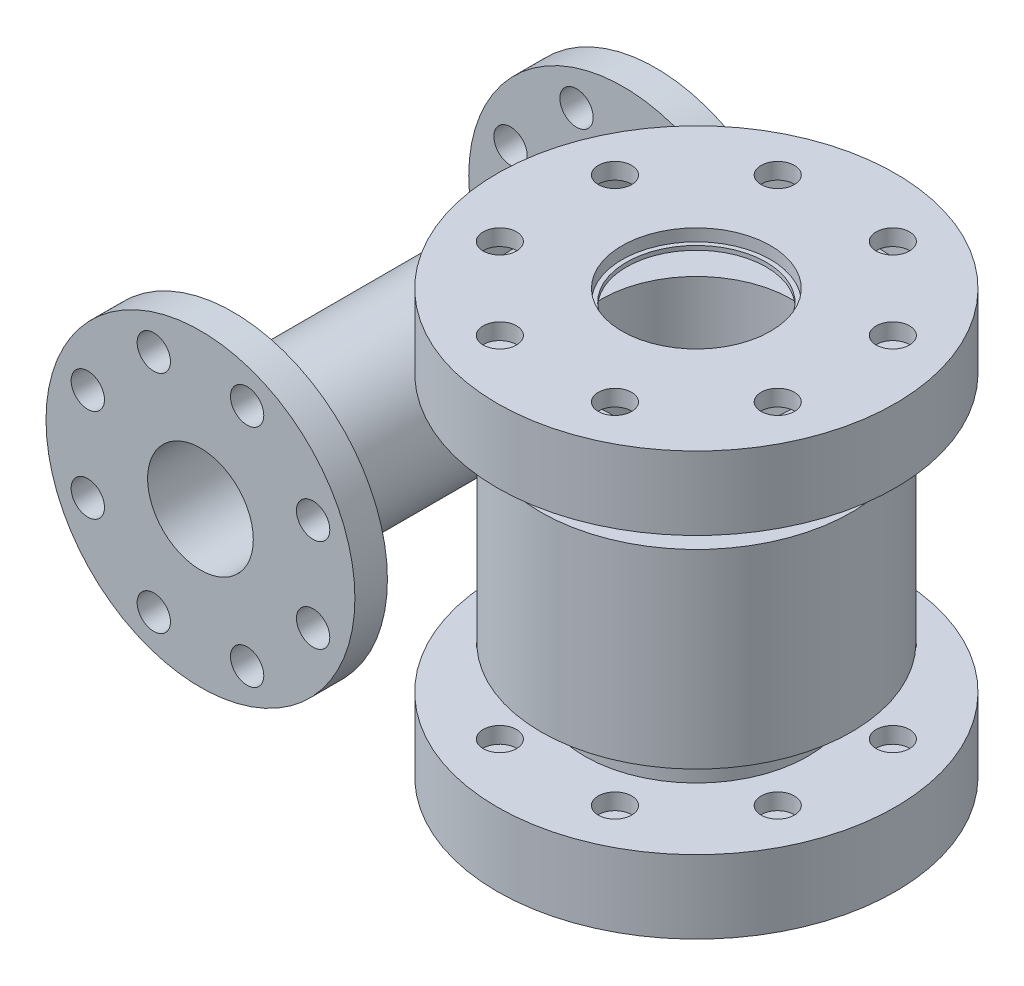
from build123d import *

# Parameters (mm, degrees)
CUT_EXTRUDE2_REACH  = 314.43
SKETCH2_R           = 10.25
CUT_EXTRUDE3_REACH  = 314.43
SKETCH3_R           = 10.25
SKETCH4_R           = 48.5
BOSS_EXTRUDE2_DEPTH = 140
SKETCH5_R           = 95
BOSS_EXTRUDE3_DEPTH = 20
SKETCH6_R           = 10.25
CUT_EXTRUDE4_DEPTH  = 20
SKETCH7_R           = 32.5
CUT_EXTRUDE5_DEPTH  = 438.258965855


with BuildPart() as part:
    # Sketch1 → Revolve-Thin1 (revolve)
    with BuildSketch(Plane.XY, mode=Mode.PRIVATE) as revolve_thin1_sk:
        Polygon((0, 202.592105263), (30.263157895, 202.592105263), (112.5, 202.592105263), (112.5, 177.592105263), (58.552631579, 177.592105263), (58.552631579, 131.092105263), (85.526315789, 131.092105263), (85.526315789, 34.092105263), (58.552631579, 34.092105263), (58.552631579, -12.407894737), (112.5, -12.407894737), (112.5, -37.407894737), (37.371153568, -37.407894737), (0, -37.407894737), (0, -47.407894737), (37.371153568, -47.407894737), (122.5, -47.407894737), (122.5, -2.407894737), (68.552631579, -2.407894737), (68.552631579, 24.092105263), (95.526315789, 24.092105263), (95.526315789, 141.092105263), (68.552631579, 141.092105263), (68.552631579, 167.592105263), (122.5, 167.592105263), (122.5, 212.592105263), (30.263157895, 212.592105263), (0, 212.592105263), align=None)
    revolve(revolve_thin1_sk.sketch.rotate(Axis((0, 217.434210526, 0), (0, -1, 0)), 90), axis=Axis((0, 217.434210526, 0), (0, -1, 0)))

    # Cut-Extrude2: up to this face of the body (flat: up to its plane)
    cut_extrude2_end = Plane(part.part.faces().sort_by_distance((0, 167.592105263, -72.017454807))[0])
    # Sketch2 → Cut-Extrude2 (cut, up to the picked face)
    with BuildSketch(Plane(origin=(0, 212.592105263, 0), x_dir=(1, 0, 0), z_dir=(0, 1, 0)), mode=Mode.PRIVATE) as cut_extrude2_sk1:
        with Locations(Location((-35.398217494, 85.458856757, 0), (0, 0, 270))):
            Circle(SKETCH2_R)
    cut_extrude2_tool1 = split(extrude(cut_extrude2_sk1.sketch, amount=-CUT_EXTRUDE2_REACH, mode=Mode.PRIVATE), bisect_by=cut_extrude2_end, keep=Keep.BOTH, mode=Mode.PRIVATE)
    # Sketch2 → Cut-Extrude2 (cut, up to the picked face)
    with BuildSketch(Plane(origin=(0, 212.592105263, 0), x_dir=(1, 0, 0), z_dir=(0, 1, 0)), mode=Mode.PRIVATE) as cut_extrude2_sk2:
        with Locations(Location((35.398217494, 85.458856757, 0), (0, 0, 270))):
            Circle(SKETCH2_R)
    cut_extrude2_tool2 = split(extrude(cut_extrude2_sk2.sketch, amount=-CUT_EXTRUDE2_REACH, mode=Mode.PRIVATE), bisect_by=cut_extrude2_end, keep=Keep.BOTH, mode=Mode.PRIVATE)
    # Sketch2 → Cut-Extrude2 (cut, up to the picked face)
    with BuildSketch(Plane(origin=(0, 212.592105263, 0), x_dir=(1, 0, 0), z_dir=(0, 1, 0)), mode=Mode.PRIVATE) as cut_extrude2_sk3:
        with Locations(Location((85.458856757, 35.398217494, 0), (0, 0, 270))):
            Circle(SKETCH2_R)
    cut_extrude2_tool3 = split(extrude(cut_extrude2_sk3.sketch, amount=-CUT_EXTRUDE2_REACH, mode=Mode.PRIVATE), bisect_by=cut_extrude2_end, keep=Keep.BOTH, mode=Mode.PRIVATE)
    # Sketch2 → Cut-Extrude2 (cut, up to the picked face)
    with BuildSketch(Plane(origin=(0, 212.592105263, 0), x_dir=(1, 0, 0), z_dir=(0, 1, 0)), mode=Mode.PRIVATE) as cut_extrude2_sk4:
        with Locations(Location((85.458856757, -35.398217494, 0), (0, 0, 270))):
            Circle(SKETCH2_R)
    cut_extrude2_tool4 = split(extrude(cut_extrude2_sk4.sketch, amount=-CUT_EXTRUDE2_REACH, mode=Mode.PRIVATE), bisect_by=cut_extrude2_end, keep=Keep.BOTH, mode=Mode.PRIVATE)
    # Sketch2 → Cut-Extrude2 (cut, up to the picked face)
    with BuildSketch(Plane(origin=(0, 212.592105263, 0), x_dir=(1, 0, 0), z_dir=(0, 1, 0)), mode=Mode.PRIVATE) as cut_extrude2_sk5:
        with Locations(Location((35.398217494, -85.458856757, 0), (0, 0, 270))):
            Circle(SKETCH2_R)
    cut_extrude2_tool5 = split(extrude(cut_extrude2_sk5.sketch, amount=-CUT_EXTRUDE2_REACH, mode=Mode.PRIVATE), bisect_by=cut_extrude2_end, keep=Keep.BOTH, mode=Mode.PRIVATE)
    # Sketch2 → Cut-Extrude2 (cut, up to the picked face)
    with BuildSketch(Plane(origin=(0, 212.592105263, 0), x_dir=(1, 0, 0), z_dir=(0, 1, 0)), mode=Mode.PRIVATE) as cut_extrude2_sk6:
        with Locations(Location((-35.398217494, -85.458856757, 0), (0, 0, 270))):
            Circle(SKETCH2_R)
    cut_extrude2_tool6 = split(extrude(cut_extrude2_sk6.sketch, amount=-CUT_EXTRUDE2_REACH, mode=Mode.PRIVATE), bisect_by=cut_extrude2_end, keep=Keep.BOTH, mode=Mode.PRIVATE)
    # Sketch2 → Cut-Extrude2 (cut, up to the picked face)
    with BuildSketch(Plane(origin=(0, 212.592105263, 0), x_dir=(1, 0, 0), z_dir=(0, 1, 0)), mode=Mode.PRIVATE) as cut_extrude2_sk7:
        with Locations(Location((-85.458856757, -35.398217494, 0), (0, 0, 270))):
            Circle(SKETCH2_R)
    cut_extrude2_tool7 = split(extrude(cut_extrude2_sk7.sketch, amount=-CUT_EXTRUDE2_REACH, mode=Mode.PRIVATE), bisect_by=cut_extrude2_end, keep=Keep.BOTH, mode=Mode.PRIVATE)
    # Sketch2 → Cut-Extrude2 (cut, up to the picked face)
    with BuildSketch(Plane(origin=(0, 212.592105263, 0), x_dir=(1, 0, 0), z_dir=(0, 1, 0)), mode=Mode.PRIVATE) as cut_extrude2_sk8:
        with Locations(Location((-85.458856757, 35.398217494, 0), (0, 0, 270))):
            Circle(SKETCH2_R)
    cut_extrude2_tool8 = split(extrude(cut_extrude2_sk8.sketch, amount=-CUT_EXTRUDE2_REACH, mode=Mode.PRIVATE), bisect_by=cut_extrude2_end, keep=Keep.BOTH, mode=Mode.PRIVATE)
    add(cut_extrude2_tool1.solids().sort_by(Axis((-35.398217, 212.592105, -85.458857), (0, -1, 0)))[0], mode=Mode.SUBTRACT)
    add(cut_extrude2_tool2.solids().sort_by(Axis((35.398217, 212.592105, -85.458857), (0, -1, 0)))[0], mode=Mode.SUBTRACT)
    add(cut_extrude2_tool3.solids().sort_by(Axis((85.458857, 212.592105, -35.398217), (0, -1, 0)))[0], mode=Mode.SUBTRACT)
    add(cut_extrude2_tool4.solids().sort_by(Axis((85.458857, 212.592105, 35.398217), (0, -1, 0)))[0], mode=Mode.SUBTRACT)
    add(cut_extrude2_tool5.solids().sort_by(Axis((35.398217, 212.592105, 85.458857), (0, -1, 0)))[0], mode=Mode.SUBTRACT)
    add(cut_extrude2_tool6.solids().sort_by(Axis((-35.398217, 212.592105, 85.458857), (0, -1, 0)))[0], mode=Mode.SUBTRACT)
    add(cut_extrude2_tool7.solids().sort_by(Axis((-85.458857, 212.592105, 35.398217), (0, -1, 0)))[0], mode=Mode.SUBTRACT)
    add(cut_extrude2_tool8.solids().sort_by(Axis((-85.458857, 212.592105, -35.398217), (0, -1, 0)))[0], mode=Mode.SUBTRACT)

    # Cut-Extrude3: up to this face of the body (flat: up to its plane)
    cut_extrude3_end = Plane(part.part.faces().sort_by_distance((0, -2.407894737, -119.035176772))[0])
    # Sketch3 → Cut-Extrude3 (cut, up to the picked face)
    with BuildSketch(Plane.XZ.offset(47.407894737), mode=Mode.PRIVATE) as cut_extrude3_sk1:
        with Locations(Location((-35.398217494, 85.458856757, 0), (0, 0, 90))):
            Circle(SKETCH3_R)
    cut_extrude3_tool1 = split(extrude(cut_extrude3_sk1.sketch, amount=-CUT_EXTRUDE3_REACH, mode=Mode.PRIVATE), bisect_by=cut_extrude3_end, keep=Keep.BOTH, mode=Mode.PRIVATE)
    # Sketch3 → Cut-Extrude3 (cut, up to the picked face)
    with BuildSketch(Plane.XZ.offset(47.407894737), mode=Mode.PRIVATE) as cut_extrude3_sk2:
        with Locations(Location((35.398510387, 85.459563864, 0), (0, 0, 270))):
            Circle(SKETCH3_R)
    cut_extrude3_tool2 = split(extrude(cut_extrude3_sk2.sketch, amount=-CUT_EXTRUDE3_REACH, mode=Mode.PRIVATE), bisect_by=cut_extrude3_end, keep=Keep.BOTH, mode=Mode.PRIVATE)
    # Sketch3 → Cut-Extrude3 (cut, up to the picked face)
    with BuildSketch(Plane.XZ.offset(47.407894737), mode=Mode.PRIVATE) as cut_extrude3_sk3:
        with Locations(Location((85.459856757, 35.399217494, 0), (0, 0, 270))):
            Circle(SKETCH3_R)
    cut_extrude3_tool3 = split(extrude(cut_extrude3_sk3.sketch, amount=-CUT_EXTRUDE3_REACH, mode=Mode.PRIVATE), bisect_by=cut_extrude3_end, keep=Keep.BOTH, mode=Mode.PRIVATE)
    # Sketch3 → Cut-Extrude3 (cut, up to the picked face)
    with BuildSketch(Plane.XZ.offset(47.407894737), mode=Mode.PRIVATE) as cut_extrude3_sk4:
        with Locations(Location((85.460563864, -35.397510387, 0), (0, 0, 270))):
            Circle(SKETCH3_R)
    cut_extrude3_tool4 = split(extrude(cut_extrude3_sk4.sketch, amount=-CUT_EXTRUDE3_REACH, mode=Mode.PRIVATE), bisect_by=cut_extrude3_end, keep=Keep.BOTH, mode=Mode.PRIVATE)
    # Sketch3 → Cut-Extrude3 (cut, up to the picked face)
    with BuildSketch(Plane.XZ.offset(47.407894737), mode=Mode.PRIVATE) as cut_extrude3_sk5:
        with Locations(Location((35.400217494, -85.458856757, 0), (0, 0, 270))):
            Circle(SKETCH3_R)
    cut_extrude3_tool5 = split(extrude(cut_extrude3_sk5.sketch, amount=-CUT_EXTRUDE3_REACH, mode=Mode.PRIVATE), bisect_by=cut_extrude3_end, keep=Keep.BOTH, mode=Mode.PRIVATE)
    # Sketch3 → Cut-Extrude3 (cut, up to the picked face)
    with BuildSketch(Plane.XZ.offset(47.407894737), mode=Mode.PRIVATE) as cut_extrude3_sk6:
        with Locations(Location((-35.396510387, -85.459563864, 0), (0, 0, 270))):
            Circle(SKETCH3_R)
    cut_extrude3_tool6 = split(extrude(cut_extrude3_sk6.sketch, amount=-CUT_EXTRUDE3_REACH, mode=Mode.PRIVATE), bisect_by=cut_extrude3_end, keep=Keep.BOTH, mode=Mode.PRIVATE)
    # Sketch3 → Cut-Extrude3 (cut, up to the picked face)
    with BuildSketch(Plane.XZ.offset(47.407894737), mode=Mode.PRIVATE) as cut_extrude3_sk7:
        with Locations(Location((-85.457856757, -35.399217494, 0), (0, 0, 270))):
            Circle(SKETCH3_R)
    cut_extrude3_tool7 = split(extrude(cut_extrude3_sk7.sketch, amount=-CUT_EXTRUDE3_REACH, mode=Mode.PRIVATE), bisect_by=cut_extrude3_end, keep=Keep.BOTH, mode=Mode.PRIVATE)
    # Sketch3 → Cut-Extrude3 (cut, up to the picked face)
    with BuildSketch(Plane.XZ.offset(47.407894737), mode=Mode.PRIVATE) as cut_extrude3_sk8:
        with Locations(Location((-85.458563864, 35.397510387, 0), (0, 0, 270))):
            Circle(SKETCH3_R)
    cut_extrude3_tool8 = split(extrude(cut_extrude3_sk8.sketch, amount=-CUT_EXTRUDE3_REACH, mode=Mode.PRIVATE), bisect_by=cut_extrude3_end, keep=Keep.BOTH, mode=Mode.PRIVATE)
    add(cut_extrude3_tool1.solids().sort_by(Axis((-35.398217, -47.407895, 85.458857), (0, 1, 0)))[0], mode=Mode.SUBTRACT)
    add(cut_extrude3_tool2.solids().sort_by(Axis((35.39851, -47.407895, 85.459564), (0, 1, 0)))[0], mode=Mode.SUBTRACT)
    add(cut_extrude3_tool3.solids().sort_by(Axis((85.459857, -47.407895, 35.399217), (0, 1, 0)))[0], mode=Mode.SUBTRACT)
    add(cut_extrude3_tool4.solids().sort_by(Axis((85.460564, -47.407895, -35.39751), (0, 1, 0)))[0], mode=Mode.SUBTRACT)
    add(cut_extrude3_tool5.solids().sort_by(Axis((35.400217, -47.407895, -85.458857), (0, 1, 0)))[0], mode=Mode.SUBTRACT)
    add(cut_extrude3_tool6.solids().sort_by(Axis((-35.39651, -47.407895, -85.459564), (0, 1, 0)))[0], mode=Mode.SUBTRACT)
    add(cut_extrude3_tool7.solids().sort_by(Axis((-85.457857, -47.407895, -35.399217), (0, 1, 0)))[0], mode=Mode.SUBTRACT)
    add(cut_extrude3_tool8.solids().sort_by(Axis((-85.458564, -47.407895, 35.39751), (0, 1, 0)))[0], mode=Mode.SUBTRACT)

    # Sketch8 → Cut-Revolve2 (revolve, cut)
    with BuildSketch(Plane.XY):
        Polygon((45.648217494, 212.592105263), (45.648217494, 205.148937664), (42.921819528, 205.148937664), (42.921819528, 198.524244021), (50, 198.524244021), (50, 120.35285903), (59.76905668, 120.35285903), (59.76905668, 82.592105263), (59.76905668, 44.389705253), (46, 44.389705253), (46, 29.815379238), (36.5, 29.815379238), (36.5, 18.332576923), (44, 18.332576923), (44, -28.04027858), (36.5, -28.04027858), (36.5, -47.407894737), (0, -47.407894737), (0, 212.592105263), align=None)
    revolve(axis=Axis((0, -47.407894737, 0), (0, 1, 0)), mode=Mode.SUBTRACT)


with BuildPart() as body_2:
    # Sketch4 → Boss-Extrude2 (new, symmetric)
    with BuildSketch(Plane.XY):
        with Locations((-165, 82.592105263)):
            Circle(SKETCH4_R)
    extrude(amount=BOSS_EXTRUDE2_DEPTH, both=True)

    # Sketch5 → Boss-Extrude3 (add)
    with BuildSketch(Plane.XY.offset(140)):
        with Locations((-165, 82.592105263)):
            Circle(SKETCH5_R)
    boss_extrude3 = extrude(amount=-BOSS_EXTRUDE3_DEPTH)

    # Sketch6 → Cut-Extrude4 (cut)
    with BuildSketch(Plane.XY.offset(140)):
        with Locations((-193.701257427, 151.883070202)):
            Circle(SKETCH6_R)
        with Locations((-136.298742573, 151.883070202)):
            Circle(SKETCH6_R)
        with Locations((-95.709035062, 111.293362691)):
            Circle(SKETCH6_R)
        with Locations((-95.709035062, 53.890847836)):
            Circle(SKETCH6_R)
        with Locations((-136.298742573, 13.301140325)):
            Circle(SKETCH6_R)
        with Locations((-193.701257427, 13.301140325)):
            Circle(SKETCH6_R)
        with Locations((-234.290964938, 53.890847836)):
            Circle(SKETCH6_R)
        with Locations((-234.290964938, 111.293362691)):
            Circle(SKETCH6_R)
    cut_extrude4 = extrude(amount=-CUT_EXTRUDE4_DEPTH, mode=Mode.SUBTRACT)

    # Mirror1: Boss-Extrude3 across plane
    add(boss_extrude3.mirror(Plane.XY))

    # Mirror2: Cut-Extrude4 across plane
    add(cut_extrude4.mirror(Plane.XY), mode=Mode.SUBTRACT)

    # Sketch7 → Cut-Extrude5 (cut, through all)
    with BuildSketch(Plane.XY.offset(140)):
        with Locations((-165, 82.592105263)):
            Circle(SKETCH7_R)
    extrude(amount=-CUT_EXTRUDE5_DEPTH, mode=Mode.SUBTRACT)


solid = Compound([part.part, body_2.part])
